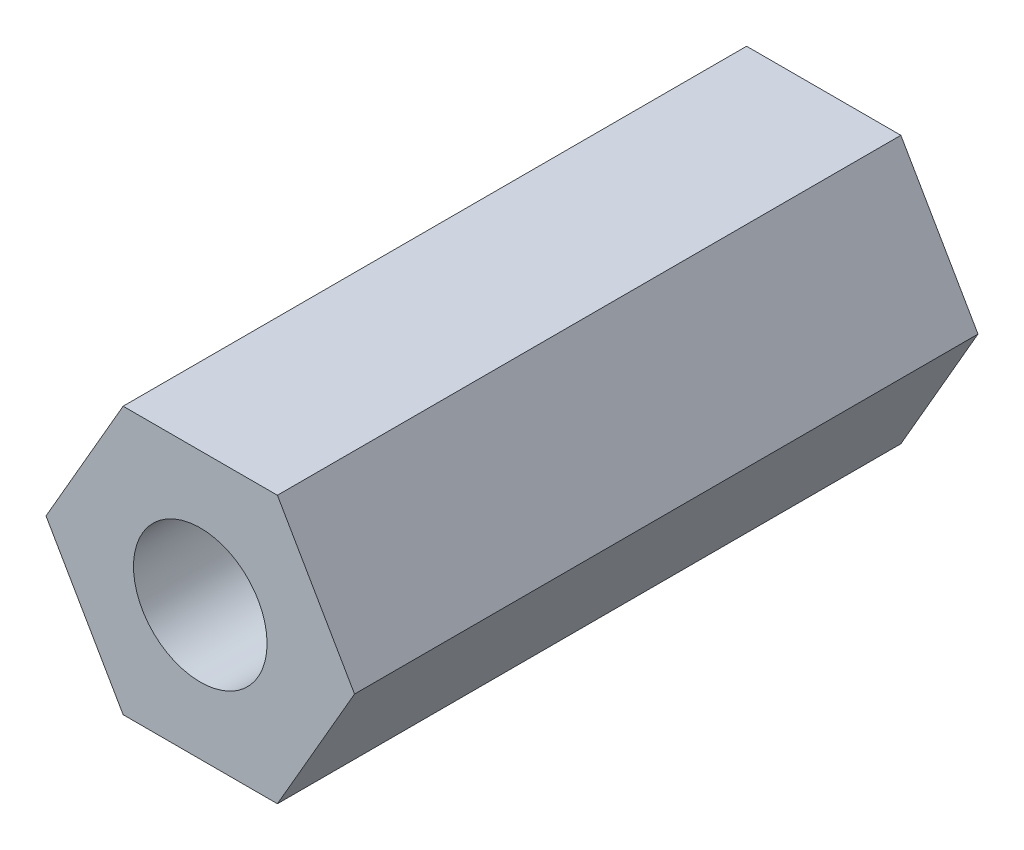
from build123d import *

# Parameters (mm, degrees)
EXTRUDE_1_DEPTH     = 13
SKETCH_2_R          = 1.5
CUT_EXTRUDE_1_DEPTH = 16.231546212
EXTRUDE_2_DEPTH     = 1
SKETCH_2_2_R        = 1.5
CUT_EXTRUDE_2_DEPTH = 14


with BuildPart() as part:
    # 草图1 → 凸台-拉伸1 (new body)
    with BuildSketch(Plane.XY):
        Polygon((0, 0), (3.464101615, 0), (5.196152423, -3), (3.464101615, -6), (0, -6), (-1.732050808, -3), align=None)
    extrude(amount=EXTRUDE_1_DEPTH)

    # 草图2 → 切除-拉伸1 (cut, through all)
    with BuildSketch(Plane.XY.offset(13)):
        with Locations((1.732050808, -3)):
            Circle(SKETCH_2_R)
    extrude(amount=-CUT_EXTRUDE_1_DEPTH, mode=Mode.SUBTRACT)

    # 草图1<2> → 凸台-拉伸2 (add)
    with BuildSketch(Plane.XY):
        Polygon((0, 0), (3.464101615, 0), (5.196152423, -3), (3.464101615, -6), (0, -6), (-1.732050808, -3), align=None)
    extrude(amount=-EXTRUDE_2_DEPTH)

    # 草图2<2> → 切除-拉伸2 (cut)
    with BuildSketch(Plane.XY.offset(13)):
        with Locations((1.732050808, -3)):
            Circle(SKETCH_2_2_R)
    extrude(amount=-CUT_EXTRUDE_2_DEPTH, mode=Mode.SUBTRACT)


solid = part.part
